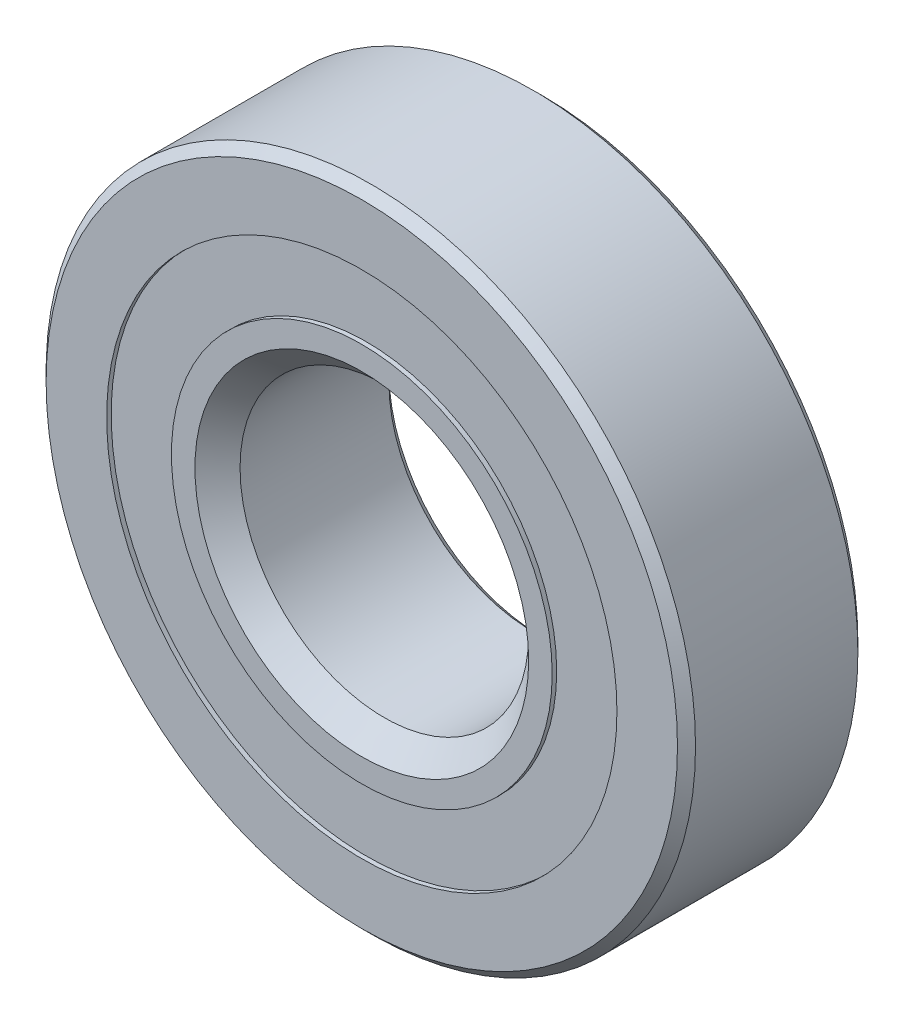
from build123d import *

# Parameters (mm, degrees)
CIRPATTERN1_COUNT = 12
SKETCH5_W         = 1.786827644
SKETCH5_H         = 2.848773


with BuildPart() as part:
    # Sketch1 → Revolve1 (revolve)
    with BuildSketch(Plane(origin=(0, 0, 0), x_dir=(0, 0, -1), z_dir=(1, 0, 0))):
        with BuildLine():
            Line((3.571875, 14.2875), (-3.571875, 14.2875))
            Line((-3.571875, 14.2875), (-3.96875, 13.890625))
            Line((-3.96875, 13.890625), (-3.96875, 11.225892857))
            Line((-3.96875, 11.225892857), (-1.763888889, 11.225892857))
            ThreePointArc((-1.763888889, 11.225892857), (0, 12.302234856), (1.763888889, 11.225892857))
            Line((1.763888889, 11.225892857), (3.96875, 11.225892857))
            Line((3.96875, 11.225892857), (3.96875, 13.890625))
            Line((3.96875, 13.890625), (3.571875, 14.2875))
        make_face()
    revolve(axis=Axis((0, 0, 3.96875), (0, 0, -1)))


with BuildPart() as body_2:
    # Sketch3 → Revolve3 (revolve)
    with BuildSketch(Plane(origin=(0, 0, 0), x_dir=(0, 0, -1), z_dir=(1, 0, 0))):
        with BuildLine():
            Line((-3.7703125, 8.178682357), (-2.934262714, 7.342632572))
            Line((-2.934262714, 7.342632572), (0, 7.342632572))
            Line((0, 7.342632572), (0, 8.335265144))
            ThreePointArc((0, 8.335265144), (1.033176668, 8.625599638), (1.763888889, 9.411607143))
            Line((1.763888889, 9.411607143), (3.96875, 9.411607143))
            Line((3.96875, 9.411607143), (3.96875, 6.746875))
            Line((3.96875, 6.746875), (3.571875, 6.35))
            Line((3.571875, 6.35), (-2.976117428, 6.35))
            Line((-2.976117428, 6.35), (-3.96875, 7.342632572))
            Line((-3.96875, 7.342632572), (-3.96875, 8.377119857))
            Line((-3.96875, 8.377119857), (-3.7703125, 8.377119857))
            Line((-3.7703125, 8.377119857), (-3.7703125, 8.178682357))
        make_face()
    revolve(axis=Axis((0, 0, 3.96875), (0, 0, -1)))


with BuildPart() as body_3:
    # Sketch4 → Revolve4 (revolve)
    with BuildSketch(Plane(origin=(0, 0, 0), x_dir=(0, 0, -1), z_dir=(1, 0, 0))):
        with BuildLine():
            Line((-1.983484856, 10.31875), (1.983484856, 10.31875))
            ThreePointArc((1.983484856, 10.31875), (0, 12.302234856), (-1.983484856, 10.31875))
        make_face()
    revolve(axis=Axis((0, 10.31875, 1.983484856), (0, 0, -1)))


with BuildPart() as cirpattern1_1:
    # CirPattern1: pattern copy
    add(body_3.part.rotate(Axis((0, 0, -3.96875), (0, 0, 1)), 1 * 360 / CIRPATTERN1_COUNT))


with BuildPart() as cirpattern1_2:
    # CirPattern1: pattern copy
    add(body_3.part.rotate(Axis((0, 0, -3.96875), (0, 0, 1)), 2 * 360 / CIRPATTERN1_COUNT))


with BuildPart() as cirpattern1_3:
    # CirPattern1: pattern copy
    add(body_3.part.rotate(Axis((0, 0, -3.96875), (0, 0, 1)), 3 * 360 / CIRPATTERN1_COUNT))


with BuildPart() as cirpattern1_4:
    # CirPattern1: pattern copy
    add(body_3.part.rotate(Axis((0, 0, -3.96875), (0, 0, 1)), 4 * 360 / CIRPATTERN1_COUNT))


with BuildPart() as cirpattern1_5:
    # CirPattern1: pattern copy
    add(body_3.part.rotate(Axis((0, 0, -3.96875), (0, 0, 1)), 5 * 360 / CIRPATTERN1_COUNT))


with BuildPart() as cirpattern1_6:
    # CirPattern1: pattern copy
    add(body_3.part.rotate(Axis((0, 0, -3.96875), (0, 0, 1)), 6 * 360 / CIRPATTERN1_COUNT))


with BuildPart() as cirpattern1_7:
    # CirPattern1: pattern copy
    add(body_3.part.rotate(Axis((0, 0, -3.96875), (0, 0, 1)), 7 * 360 / CIRPATTERN1_COUNT))


with BuildPart() as cirpattern1_8:
    # CirPattern1: pattern copy
    add(body_3.part.rotate(Axis((0, 0, -3.96875), (0, 0, 1)), 8 * 360 / CIRPATTERN1_COUNT))


with BuildPart() as cirpattern1_9:
    # CirPattern1: pattern copy
    add(body_3.part.rotate(Axis((0, 0, -3.96875), (0, 0, 1)), 9 * 360 / CIRPATTERN1_COUNT))


with BuildPart() as cirpattern1_10:
    # CirPattern1: pattern copy
    add(body_3.part.rotate(Axis((0, 0, -3.96875), (0, 0, 1)), 10 * 360 / CIRPATTERN1_COUNT))


with BuildPart() as cirpattern1_11:
    # CirPattern1: pattern copy
    add(body_3.part.rotate(Axis((0, 0, -3.96875), (0, 0, 1)), 11 * 360 / CIRPATTERN1_COUNT))


with BuildPart() as body_15:
    # Sketch5 → Revolve5 (revolve)
    with BuildSketch(Plane(origin=(0, 0, 0), x_dir=(0, 0, -1), z_dir=(1, 0, 0))):
        with Locations((-2.876898678, 9.801506357)):
            Rectangle(SKETCH5_W, SKETCH5_H)
        with Locations((2.876898678, 9.801506357)):
            Rectangle(SKETCH5_W, SKETCH5_H)
    revolve(axis=Axis((0, 0, 3.96875), (0, 0, -1)))


solid = Compound([part.part, body_2.part, body_3.part, cirpattern1_1.part, cirpattern1_2.part, cirpattern1_3.part, cirpattern1_4.part, cirpattern1_5.part, cirpattern1_6.part, cirpattern1_7.part, cirpattern1_8.part, cirpattern1_9.part, cirpattern1_10.part, cirpattern1_11.part, body_15.part])
